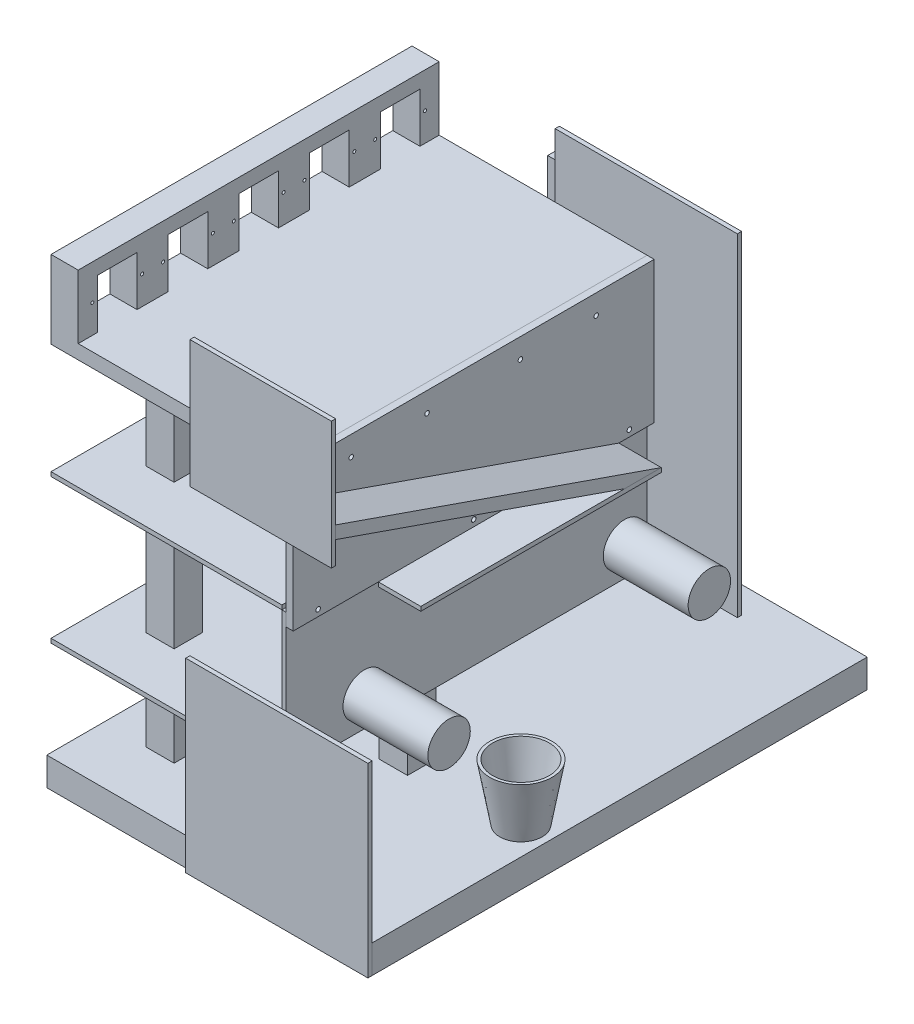
from build123d import *

# Parameters (mm, degrees)
BOSS_EXTRUDE1_DEPTH    = 236
SKETCH2_R              = 1.075
SKETCH2_W              = 28
SKETCH2_H              = 35
CUT_EXTRUDE1_DEPTH     = 236
BOSS_EXTRUDE3_DEPTH    = 19.2
LPATTERN2_COUNT        = 5
LPATTERN2_PITCH        = 50
SKETCH11_W             = 5
SKETCH11_H             = 255.2
BOSS_EXTRUDE6_DEPTH    = 100
SKETCH12_W             = 3
SKETCH12_H             = 6
BOSS_EXTRUDE7_DEPTH    = 8
SKETCH13_R             = 1.6
CUT_EXTRUDE2_DEPTH     = 70
SKETCH14_R             = 1.6
CUT_EXTRUDE4_DEPTH     = 70
BOSS_EXTRUDE8_DEPTH    = 30
SKETCH16_W             = 201.2
SKETCH16_H             = 145
BOSS_EXTRUDE9_DEPTH    = 3
SKETCH18_W             = 255.2
SKETCH18_H             = 99
BOSS_EXTRUDE12_DEPTH   = 3
CUT_EXTRUDE5_START     = -8
SKETCH19_R             = 1.6
CUT_EXTRUDE5_DEPTH     = 8
SKETCH27_R             = 1.6
SKETCH27_R_2           = 11.05
CUT_EXTRUDE9_DEPTH     = 103
SKETCH28_R             = 15
BOSS_EXTRUDE14_DEPTH   = 60
BOSS_EXTRUDE14_2_DEPTH = 60
BOSS_EXTRUDE15_START   = 70
SKETCH29_W             = 230
SKETCH29_H             = 350
BOSS_EXTRUDE15_DEPTH   = 20
SKETCH30_W             = 20
SKETCH30_H             = 20
BOSS_EXTRUDE17_DEPTH   = 250
BOSS_EXTRUDE17_2_DEPTH = 250
BOSS_EXTRUDE17_3_DEPTH = 250
CUT_EXTRUDE10_DEPTH    = 3
SKETCH33_W             = 201.2
SKETCH33_H             = 145
CUT_EXTRUDE11_DEPTH    = 3
BOSS_EXTRUDE18_DEPTH   = 3
SKETCH36_R             = 15
BOSS_EXTRUDE19_DEPTH   = 40
BOSS_EXTRUDE19_DRAFT   = -10
SHELL1_T               = -2
SKETCH45_W             = 128.8
SKETCH45_H             = 131.410170262
BOSS_EXTRUDE20_DEPTH   = 3
SKETCH46_W             = 20
SKETCH46_H             = 20
BOSS_EXTRUDE21_DEPTH   = 250
SKETCH47_W             = 20
SKETCH47_H             = 20
BOSS_EXTRUDE22_DEPTH   = 50
BOSS_EXTRUDE23_START   = -20
SKETCH48_R             = 30
BOSS_EXTRUDE23_DEPTH   = 180
BOSS_EXTRUDE23_DRAFT   = -3
SHELL2_T               = -2
SKETCH49_W             = 30
SKETCH49_H             = 170
BOSS_EXTRUDE24_DEPTH   = 3
SKETCH50_W             = 163.2
SKETCH50_H             = 255.2
SKETCH50_W_2           = 20
SKETCH50_H_2           = 20
BOSS_EXTRUDE25_DEPTH   = 3
SKETCH51_W             = 163.2
SKETCH51_H             = 255.2
SKETCH51_W_2           = 20
SKETCH51_H_2           = 20
BOSS_EXTRUDE27_DEPTH   = 3


with BuildPart() as part:
    # Sketch1 → Boss-Extrude1 (new body)
    with BuildSketch(Plane.XY):
        Polygon((0, 0), (0, 55), (19.2, 55), (19.2, 10), (166.2, 10), (166.2, 0), align=None)
    extrude(amount=BOSS_EXTRUDE1_DEPTH)

    # Sketch2 → Cut-Extrude1 (cut)
    with BuildSketch(Plane(origin=(19.2, 0, 0), x_dir=(0, 0, -1), z_dir=(1, 0, 0))):
        with Locations(Location((-226, 30, 0), (0, 0, 90))):
            Circle(SKETCH2_R)
        with Locations(Location((-190.8, 30, 0), (0, 0, 90))):
            Circle(SKETCH2_R)
        with Locations((-208.4, 27.5)):
            Rectangle(SKETCH2_W, SKETCH2_H)
    cut_extrude1 = extrude(amount=-CUT_EXTRUDE1_DEPTH, mode=Mode.SUBTRACT)

    # Sketch4 → Boss-Extrude3 (add)
    with BuildSketch(Plane(origin=(0, 0, 0), x_dir=(-1, 0, 0), z_dir=(0, 0, -1))):
        Polygon((-166.2, 0), (0, 0), (0, 55), (-19.2, 55), (-19.2, 10), (-166.2, 10), align=None)
    extrude(amount=BOSS_EXTRUDE3_DEPTH)

    # LPattern2: Cut-Extrude1 ×5
    with Locations(*[(0, 0, -i * LPATTERN2_PITCH) for i in range(1, LPATTERN2_COUNT)]):
        add(cut_extrude1, mode=Mode.SUBTRACT)

    # Sketch12 → Boss-Extrude7 (add)
    with BuildSketch(Plane.XZ):
        with Locations((164.7, 21.8)):
            Rectangle(SKETCH12_W, SKETCH12_H)
        with Locations((164.7, 195)):
            Rectangle(SKETCH12_W, SKETCH12_H)
        with Locations((164.7, 75.4)):
            Rectangle(SKETCH12_W, SKETCH12_H)
        with Locations((164.7, 141.4)):
            Rectangle(SKETCH12_W, SKETCH12_H)
    extrude(amount=BOSS_EXTRUDE7_DEPTH)


with BuildPart() as body_2:
    # Sketch11 → Boss-Extrude6 (new body)
    with BuildSketch(Plane(origin=(0, 10, 0), x_dir=(1, 0, 0), z_dir=(0, 1, 0))):
        with Locations((168.7, -108.4)):
            Rectangle(SKETCH11_W, SKETCH11_H)
    extrude(amount=-BOSS_EXTRUDE6_DEPTH)


with BuildPart() as cut_extrude2_tool:
    # Sketch13 → Cut-Extrude2 (new body)
    with BuildSketch(Plane.ZY.offset(-163.2)):
        with Locations((75.4, -4)):
            Circle(SKETCH13_R)
    cut_extrude2 = extrude(amount=-CUT_EXTRUDE2_DEPTH)


with BuildPart() as part_1:
    add(part.part)

    # Cut-Extrude2: cut by cut_extrude2_tool
    add(cut_extrude2_tool.part, mode=Mode.SUBTRACT)


with BuildPart() as body_2_1:
    add(body_2.part)

    # Cut-Extrude2: cut by cut_extrude2_tool
    add(cut_extrude2_tool.part, mode=Mode.SUBTRACT)


with BuildPart() as mirror1_tool:
    # Mirror1: Cut-Extrude2 across plane
    add(cut_extrude2.mirror(Plane.XY.offset(108.4)))


with BuildPart() as part_2:
    add(part_1.part)

    # Mirror1: cut by mirror1_tool
    add(mirror1_tool.part, mode=Mode.SUBTRACT)


with BuildPart() as body_2_2:
    add(body_2_1.part)

    # Mirror1: cut by mirror1_tool
    add(mirror1_tool.part, mode=Mode.SUBTRACT)


with BuildPart() as cut_extrude4_tool:
    # Sketch14 → Cut-Extrude4 (new body)
    with BuildSketch(Plane.ZY.offset(-163.2)):
        with Locations((21.8, -4)):
            Circle(SKETCH14_R)
    cut_extrude4 = extrude(amount=-CUT_EXTRUDE4_DEPTH)


with BuildPart() as part_3:
    add(part_2.part)

    # Cut-Extrude4: cut by cut_extrude4_tool
    add(cut_extrude4_tool.part, mode=Mode.SUBTRACT)


with BuildPart() as body_2_3:
    add(body_2_2.part)

    # Cut-Extrude4: cut by cut_extrude4_tool
    add(cut_extrude4_tool.part, mode=Mode.SUBTRACT)


with BuildPart() as mirror2_tool:
    # Mirror2: Cut-Extrude4 across plane
    add(cut_extrude4.mirror(Plane.XY.offset(108.4)))


with BuildPart() as part_4:
    add(part_3.part)

    # Mirror2: cut by mirror2_tool
    add(mirror2_tool.part, mode=Mode.SUBTRACT)


with BuildPart() as body_2_4:
    add(body_2_3.part)

    # Mirror2: cut by mirror2_tool
    add(mirror2_tool.part, mode=Mode.SUBTRACT)

    # Sketch15 → Boss-Extrude8 (add)
    with BuildSketch(Plane(origin=(171.2, 0, 0), x_dir=(0, 0, -1), z_dir=(1, 0, 0))):
        Polygon((-31.6975, -90), (-5.8, -90), (-236, -10), (-236, -19), align=None)
    extrude(amount=BOSS_EXTRUDE8_DEPTH)


with BuildPart() as body_3:
    # Sketch16 → Boss-Extrude9 (new body)
    with BuildSketch(Plane.XY.offset(236)):
        with Locations((100.6, -17.5)):
            Rectangle(SKETCH16_W, SKETCH16_H)
    extrude(amount=BOSS_EXTRUDE9_DEPTH)


with BuildPart() as body_4:
    # Mirror3: mirrored copy
    add(body_3.part.mirror(Plane.XY.offset(108.4)))

    # Sketch33 → Cut-Extrude11 (cut)
    with BuildSketch(Plane(origin=(0, 0, -22.2), x_dir=(-1, 0, 0), z_dir=(0, 0, -1))):
        with Locations((-100.6, -17.5)):
            Rectangle(SKETCH33_W, SKETCH33_H)
    extrude(amount=-CUT_EXTRUDE11_DEPTH, mode=Mode.SUBTRACT)


with BuildPart() as body_5:
    # Sketch18 → Boss-Extrude12 (new body)
    with BuildSketch(Plane.ZY.offset(-166.2)):
        with Locations((108.4, -130.5)):
            Rectangle(SKETCH18_W, SKETCH18_H)
    extrude(amount=BOSS_EXTRUDE12_DEPTH)


with BuildPart() as cut_extrude5_tool:
    # Sketch19 → Cut-Extrude5 (new body)
    with BuildSketch(Plane.ZY.offset(-163.2).offset(CUT_EXTRUDE5_START)):
        with Locations((-1.655494296, -85.5)):
            Circle(SKETCH19_R)
        with Locations((218.344505704, -85.5)):
            Circle(SKETCH19_R)
        with Locations((108.344505704, -85.5)):
            Circle(SKETCH19_R)
    extrude(amount=CUT_EXTRUDE5_DEPTH)


with BuildPart() as body_2_5:
    add(body_2_4.part)

    # Cut-Extrude5: cut by cut_extrude5_tool
    add(cut_extrude5_tool.part, mode=Mode.SUBTRACT)


with BuildPart() as body_5_1:
    add(body_5.part)

    # Cut-Extrude5: cut by cut_extrude5_tool
    add(cut_extrude5_tool.part, mode=Mode.SUBTRACT)

    # Sketch27 → Cut-Extrude9 (cut)
    with BuildSketch(Plane(origin=(166.2, 0, 0), x_dir=(0, 0, -1), z_dir=(1, 0, 0))):
        with Locations((3.2, -158.85)):
            Circle(SKETCH27_R)
        with Locations((-180.8, -158.85)):
            Circle(SKETCH27_R_2)
    extrude(amount=-CUT_EXTRUDE9_DEPTH, mode=Mode.SUBTRACT)


with BuildPart() as body_6:
    # Sketch28 → Boss-Extrude14 (new body)
    with BuildSketch(Plane(origin=(166.2, 0, 0), x_dir=(0, 0, -1), z_dir=(1, 0, 0))):
        with Locations((-180.8, -158.85)):
            Circle(SKETCH28_R)
    extrude(amount=BOSS_EXTRUDE14_DEPTH)


with BuildPart() as body_7:
    # Sketch28 → Boss-Extrude14 2 (new body)
    with BuildSketch(Plane(origin=(166.2, 0, 0), x_dir=(0, 0, -1), z_dir=(1, 0, 0))):
        with Locations((3.2, -158.85)):
            Circle(SKETCH28_R)
    extrude(amount=BOSS_EXTRUDE14_2_DEPTH)


with BuildPart() as body_8:
    # Sketch29 → Boss-Extrude15 (new body)
    with BuildSketch(Plane.XZ.offset(180).offset(BOSS_EXTRUDE15_START)):
        with Locations((115, 64)):
            Rectangle(SKETCH29_W, SKETCH29_H)
    extrude(amount=BOSS_EXTRUDE15_DEPTH)


with BuildPart() as body_9:
    # Sketch30 → Boss-Extrude17 (new body)
    with BuildSketch(Plane.XZ):
        with Locations((40, 39)):
            Rectangle(SKETCH30_W, SKETCH30_H)
    extrude(amount=BOSS_EXTRUDE17_DEPTH)


with BuildPart() as body_10:
    # Sketch30 → Boss-Extrude17 2 (new body)
    with BuildSketch(Plane.XZ):
        with Locations((40, 189)):
            Rectangle(SKETCH30_W, SKETCH30_H)
    extrude(amount=BOSS_EXTRUDE17_2_DEPTH)


with BuildPart() as body_11:
    # Sketch30 → Boss-Extrude17 3 (new body)
    with BuildSketch(Plane.XZ):
        with Locations((130, 114)):
            Rectangle(SKETCH30_W, SKETCH30_H)
    extrude(amount=BOSS_EXTRUDE17_3_DEPTH)


with BuildPart() as body_3_1:
    add(body_3.part)

    # Sketch31 → Cut-Extrude10 (cut)
    with BuildSketch(Plane.XY.offset(239)):
        Polygon((101.2, 55), (101.2, -35), (201.2, -35), (201.2, -90), (0, -90), (0, 55), align=None)
    extrude(amount=-CUT_EXTRUDE10_DEPTH, mode=Mode.SUBTRACT)


with BuildPart() as body_11_2:
    # Sketch34 → Boss-Extrude18 (new body)
    with BuildSketch(Plane(origin=(0, 0, -19.2), x_dir=(-1, 0, 0), z_dir=(0, 0, -1))):
        Polygon((-230, -180), (-230, 55), (-101.2, 55), (-101.2, -180), (-163.2, -180), (-166.2, -180), align=None)
    extrude(amount=BOSS_EXTRUDE18_DEPTH)


with BuildPart() as body_12:
    # Sketch36 → Boss-Extrude19 (with draft: the straight prism first)
    with BuildSketch(Plane(origin=(0, -250, 0), x_dir=(1, 0, 0), z_dir=(0, 1, 0))):
        with Locations((210.207024363, -114)):
            Circle(SKETCH36_R)
    extrude(amount=BOSS_EXTRUDE19_DEPTH)
    # Boss-Extrude19: the draft: its side faces are tilted about the plane it starts from
    boss_extrude19_sides = [body_12.faces().sort_by_distance(p)[0] for p in [
        (195.207024363, -230, 114),
    ]]
    draft(boss_extrude19_sides, Plane(origin=(0, -250, 0), x_dir=(1, 0, 0), z_dir=(0, 1, 0)), BOSS_EXTRUDE19_DRAFT)

    # Shell1
    shell1_openings = [body_12.faces().sort_by_distance(p)[0] for p in [
        (210.207024363, -210, 114),
    ]]
    offset(amount=SHELL1_T, openings=shell1_openings, kind=Kind.INTERSECTION)


with BuildPart() as body_13:
    # Sketch45 → Boss-Extrude20 (new body)
    with BuildSketch(Plane.XY.offset(239)):
        with Locations((165.6, -204.294914869)):
            Rectangle(SKETCH45_W, SKETCH45_H)
    extrude(amount=BOSS_EXTRUDE20_DEPTH)


with BuildPart() as body_14:
    # Sketch46 → Boss-Extrude21 (new body)
    with BuildSketch(Plane(origin=(0, -250, 0), x_dir=(1, 0, 0), z_dir=(0, 1, 0))):
        with Locations((70, 65.1)):
            Rectangle(SKETCH46_W, SKETCH46_H)
    extrude(amount=BOSS_EXTRUDE21_DEPTH)

    # Sketch47 → Boss-Extrude22 (add)
    with BuildSketch(Plane(origin=(80, 0, 0), x_dir=(0, 0, -1), z_dir=(1, 0, 0))):
        with Locations((65.1, -10)):
            Rectangle(SKETCH47_W, SKETCH47_H)
    extrude(amount=BOSS_EXTRUDE22_DEPTH)


with BuildPart() as body_15:
    # Sketch48 → Boss-Extrude23 (with draft: the straight prism first)
    with BuildSketch(Plane(origin=(0, 0, 0), x_dir=(1, 0, 0), z_dir=(0, 1, 0)).offset(BOSS_EXTRUDE23_START)):
        with Locations((115, 65.1)):
            Circle(SKETCH48_R)
    extrude(amount=-BOSS_EXTRUDE23_DEPTH)
    # Boss-Extrude23: the draft: its side faces are tilted about the plane it starts from
    boss_extrude23_sides = [body_15.faces().sort_by_distance(p)[0] for p in [
        (85, -110, -65.1),
    ]]
    draft(boss_extrude23_sides, Plane(origin=(0, 0, 0), x_dir=(1, 0, 0), z_dir=(0, 1, 0)).offset(BOSS_EXTRUDE23_START), BOSS_EXTRUDE23_DRAFT)

    # Shell2
    shell2_openings = [body_15.faces().sort_by_distance(p)[0] for p in [
        (115, -20, -65.1),
    ]]
    offset(amount=SHELL2_T, openings=shell2_openings, kind=Kind.INTERSECTION)


with BuildPart() as body_16:
    # Sketch49 → Boss-Extrude24 (new body)
    with BuildSketch(Plane.XZ.offset(90)):
        with Locations((186.2, 90.8)):
            Rectangle(SKETCH49_W, SKETCH49_H)
    extrude(amount=BOSS_EXTRUDE24_DEPTH)


with BuildPart() as body_17:
    # Sketch50 → Boss-Extrude25 (new body)
    with BuildSketch(Plane.XZ.offset(180)):
        with Locations((81.6, 108.4)):
            Rectangle(SKETCH50_W, SKETCH50_H)
        with Locations((40, 39)):
            Rectangle(SKETCH50_W_2, SKETCH50_H_2, mode=Mode.SUBTRACT)
        with Locations((40, 189)):
            Rectangle(SKETCH50_W_2, SKETCH50_H_2, mode=Mode.SUBTRACT)
        with Locations((130, 114)):
            Rectangle(SKETCH50_W_2, SKETCH50_H_2, mode=Mode.SUBTRACT)
    extrude(amount=BOSS_EXTRUDE25_DEPTH)


with BuildPart() as body_18:
    # Sketch51 → Boss-Extrude27 (new body)
    with BuildSketch(Plane(origin=(0, -81, 0), x_dir=(1, 0, 0), z_dir=(0, 1, 0))):
        with Locations((81.6, -108.4)):
            Rectangle(SKETCH51_W, SKETCH51_H)
        with Locations((130, -114)):
            Rectangle(SKETCH51_W_2, SKETCH51_H_2, mode=Mode.SUBTRACT)
        with Locations((40, -39)):
            Rectangle(SKETCH51_W_2, SKETCH51_H_2, mode=Mode.SUBTRACT)
        with Locations((40, -189)):
            Rectangle(SKETCH51_W_2, SKETCH51_H_2, mode=Mode.SUBTRACT)
    extrude(amount=BOSS_EXTRUDE27_DEPTH)


solid = Compound([part_4.part, body_2_5.part, body_5_1.part, body_6.part, body_7.part, body_8.part, body_9.part, body_10.part, body_11.part, body_3_1.part, body_11_2.part, body_12.part, body_13.part, body_14.part, body_15.part, body_16.part, body_17.part, body_18.part])
